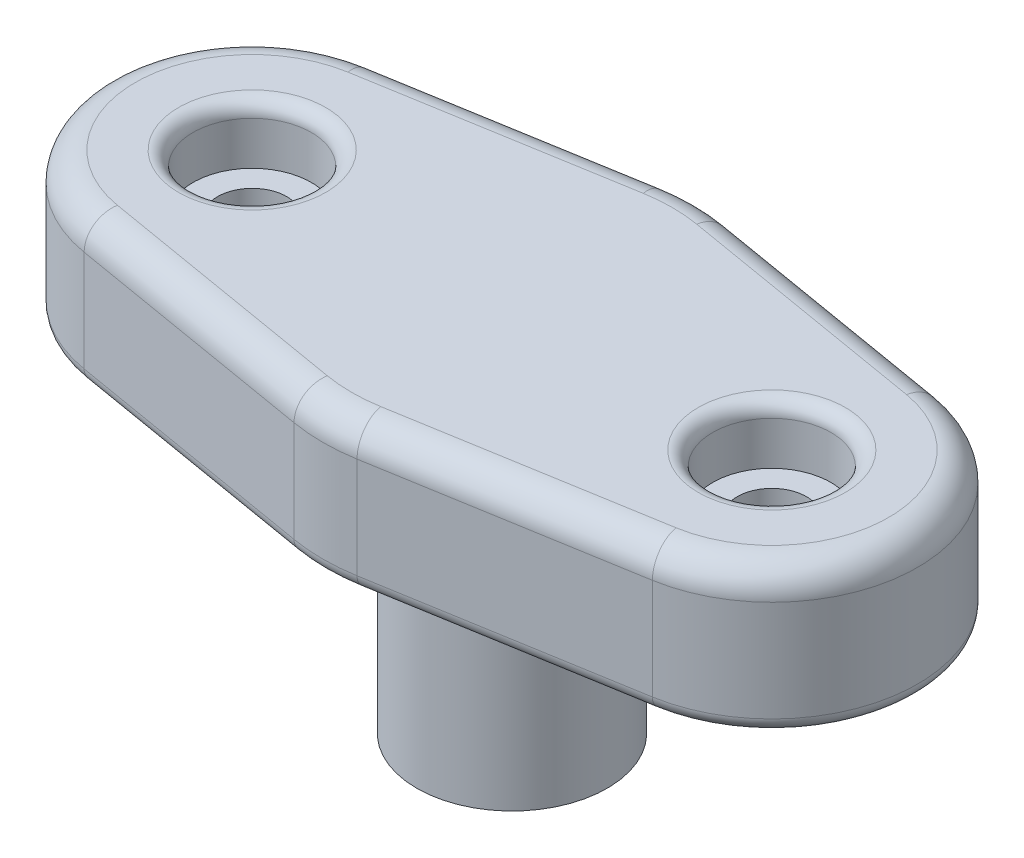
from build123d import *

# Parameters (mm, degrees)
SKETCH1_R           = 3.3
BOSS_EXTRUDE1_DEPTH = 8
SKETCH2_R           = 1.2
BOSS_EXTRUDE2_DEPTH = 5
SKETCH3_R           = 2.05
CUT_EXTRUDE1_DEPTH  = 2
FILLET1_R           = 0.5
FILLET2_R           = 1


with BuildPart() as part:
    # Sketch1 → Boss-Extrude1 (new body)
    with BuildSketch(Plane(origin=(0, 0, 0), x_dir=(1, 0, 0), z_dir=(0, 1, 0))):
        with Locations(Location((0, 0, 0), (0, 0, 270))):
            Circle(SKETCH1_R)
    extrude(amount=BOSS_EXTRUDE1_DEPTH)

    # Sketch2 → Boss-Extrude2 (add)
    with BuildSketch(Plane(origin=(0, 8, 0), x_dir=(1, 0, 0), z_dir=(0, 1, 0))):
        with BuildLine():
            Line((-9.841666667, 4.979367151), (-1.091666667, 6.458387097))
            ThreePointArc((-1.091666667, 6.458387097), (0, 6.55), (1.091666667, 6.458387097))
            Line((1.091666667, 6.458387097), (9.841666667, 4.979367151))
            ThreePointArc((9.841666667, 4.979367151), (14.05, 0), (9.841666667, -4.979367151))
            Line((9.841666667, -4.979367151), (1.091666667, -6.458387097))
            ThreePointArc((1.091666667, -6.458387097), (0, -6.55), (-1.091666667, -6.458387097))
            Line((-1.091666667, -6.458387097), (-9.841666667, -4.979367151))
            ThreePointArc((-9.841666667, -4.979367151), (-14.05, 0), (-9.841666667, 4.979367151))
        make_face()
        with Locations(Location((-9, 0, 0), (0, 0, 270))):
            Circle(SKETCH2_R, mode=Mode.SUBTRACT)
        with Locations(Location((9, 0, 0), (0, 0, 270))):
            Circle(SKETCH2_R, mode=Mode.SUBTRACT)
    extrude(amount=BOSS_EXTRUDE2_DEPTH)

    # Sketch3 → Cut-Extrude1 (cut)
    with BuildSketch(Plane(origin=(0, 13, 0), x_dir=(1, 0, 0), z_dir=(0, 1, 0))):
        with Locations(Location((-9, 0, 0), (0, 0, 270))):
            Circle(SKETCH3_R)
        with Locations(Location((9, 0, 0), (0, 0, 270))):
            Circle(SKETCH3_R)
    extrude(amount=-CUT_EXTRUDE1_DEPTH, mode=Mode.SUBTRACT)

    # Fillet1
    fillet1_edges = [part.edges().sort_by_distance(p)[0] for p in [
        (5.466666667, 8, 5.718877124),
        (14.05, 8, 0),
        (5.466666667, 8, -5.718877124),
        (0, 8, -6.55),
        (-5.466666667, 8, -5.718877124),
        (-9, 13, -2.05),
        (9, 13, -2.05),
        (-14.05, 8, 0),
        (-5.466666667, 8, 5.718877124),
        (0, 8, 6.55),
    ]]
    fillet(fillet1_edges, radius=FILLET1_R)

    # Fillet2
    fillet2_edges = [part.edges().sort_by_distance(p)[0] for p in [
        (-14.05, 13, 0),
        (-5.466666667, 13, 5.718877124),
        (0, 13, 6.55),
        (5.466666667, 13, 5.718877124),
        (14.05, 13, 0),
        (5.466666667, 13, -5.718877124),
        (0, 13, -6.55),
        (-5.466666667, 13, -5.718877124),
    ]]
    fillet(fillet2_edges, radius=FILLET2_R)


solid = part.part
